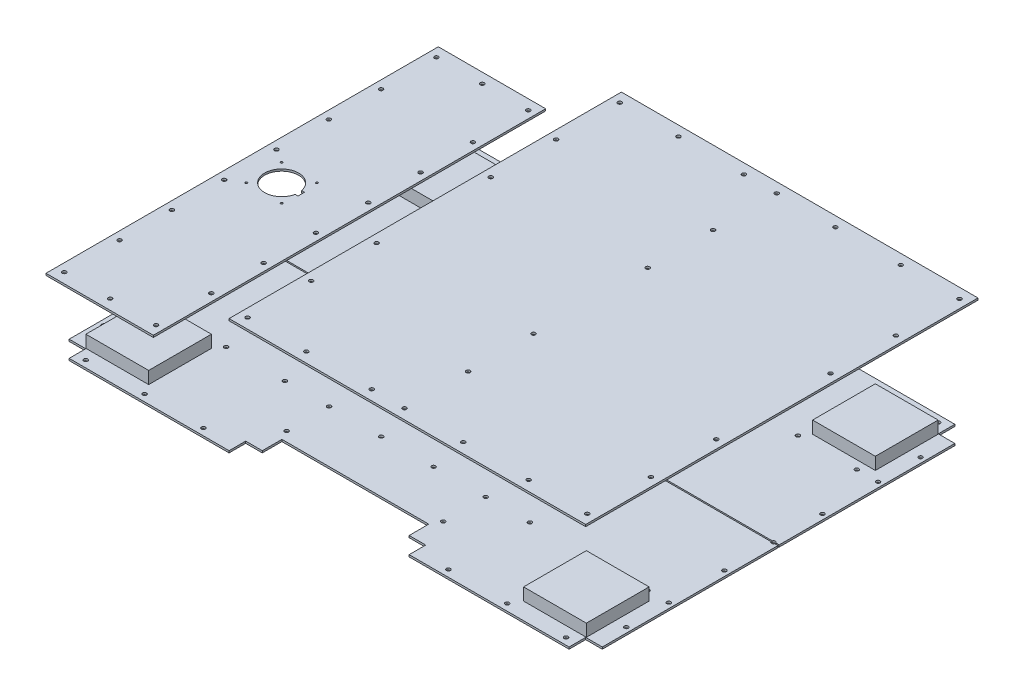
from build123d import *

# Parameters (mm, degrees)
SKETCH2_R             = 3
BOSS_EXTRUDE1_DEPTH   = 3
BOSS_EXTRUDE1_2_DEPTH = 3
SKETCH4_W             = 545.4
SKETCH4_H             = 600
SKETCH4_R             = 3
BOSS_EXTRUDE2_DEPTH   = 3
SKETCH6_R             = 3
BOSS_EXTRUDE3_DEPTH   = 3
CUT_EXTRUDE1_DEPTH    = 3
SKETCH10_R            = 1.6
CUT_EXTRUDE4_DEPTH    = 3
SKETCH13_W            = 90
SKETCH13_H            = 90
CUT_EXTRUDE6_DEPTH    = 3
BOSS_EXTRUDE4_START   = -3
SKETCH15_W            = 96
SKETCH15_H            = 96
BOSS_EXTRUDE4_DEPTH   = 18.8
SKETCH16_W            = 90
SKETCH16_H            = 90
CUT_EXTRUDE7_DEPTH    = 18.8


with BuildPart() as part:
    # Sketch2 → Boss-Extrude1 (new body)
    with BuildSketch(Plane(origin=(0, 422.059491285, 0), x_dir=(1, 0, 0), z_dir=(0, 1, 0))):
        with BuildLine():
            Line((711.295088764, -928.695168064), (711.295088764, -660.095168064))
            Line((711.295088764, -660.095168064), (706.223515889, -660.095168064))
            ThreePointArc((706.223515889, -660.095168064), (703.395088764, -662.095168064), (700.56666164, -660.095168064))
            Line((700.56666164, -660.095168064), (426.223515889, -660.095168064))
            ThreePointArc((426.223515889, -660.095168064), (423.395088764, -662.095168064), (420.56666164, -660.095168064))
            Line((420.56666164, -660.095168064), (186.623515889, -660.095168064))
            ThreePointArc((186.623515889, -660.095168064), (183.795088764, -662.095168064), (180.96666164, -660.095168064))
            Line((180.96666164, -660.095168064), (-93.376484111, -660.095168064))
            ThreePointArc((-93.376484111, -660.095168064), (-96.204911236, -662.095168064), (-99.03333836, -660.095168064))
            Line((-99.03333836, -660.095168064), (-104.104911236, -660.095168064))
            Line((-104.104911236, -660.095168064), (-104.104911236, -928.695168064))
            Line((-104.104911236, -928.695168064), (-78.704911236, -928.695168064))
            Line((-78.704911236, -928.695168064), (-78.704911236, -954.095168064))
            Line((-78.704911236, -954.095168064), (165.895088764, -954.095168064))
            Line((165.895088764, -954.095168064), (165.895088764, -928.695168064))
            Line((165.895088764, -928.695168064), (191.295088764, -928.695168064))
            Line((191.295088764, -928.695168064), (191.295088764, -898.695168064))
            Line((191.295088764, -898.695168064), (415.895088764, -898.695168064))
            Line((415.895088764, -898.695168064), (415.895088764, -928.695168064))
            Line((415.895088764, -928.695168064), (441.295088764, -928.695168064))
            Line((441.295088764, -928.695168064), (441.295088764, -954.095168064))
            Line((441.295088764, -954.095168064), (685.895088764, -954.095168064))
            Line((685.895088764, -954.095168064), (685.895088764, -928.695168064))
            Line((685.895088764, -928.695168064), (711.295088764, -928.695168064))
        make_face()
        with Locations(Location((-63.704911236, -943.695168064, 0), (0, 0, 270))):
            Circle(SKETCH2_R, mode=Mode.SUBTRACT)
        with Locations(Location((-96.204911236, -884.095168064, 0), (0, 0, 270))):
            Circle(SKETCH2_R, mode=Mode.SUBTRACT)
        with Locations(Location((26.295088764, -943.695168064, 0), (0, 0, 270))):
            Circle(SKETCH2_R, mode=Mode.SUBTRACT)
        with Locations(Location((-96.204911236, -819.095168064, 0), (0, 0, 270))):
            Circle(SKETCH2_R, mode=Mode.SUBTRACT)
        with Locations(Location((-63.704911236, -819.095168064, 0), (0, 0, 270))):
            Circle(SKETCH2_R, mode=Mode.SUBTRACT)
        with Locations(Location((26.295088764, -819.095168064, 0), (0, 0, 270))):
            Circle(SKETCH2_R, mode=Mode.SUBTRACT)
        with Locations(Location((116.295088764, -943.695168064, 0), (0, 0, 270))):
            Circle(SKETCH2_R, mode=Mode.SUBTRACT)
        with Locations(Location((183.795088764, -884.095168064, 0), (0, 0, 270))):
            Circle(SKETCH2_R, mode=Mode.SUBTRACT)
        with Locations(Location((116.295088764, -819.095168064, 0), (0, 0, 270))):
            Circle(SKETCH2_R, mode=Mode.SUBTRACT)
        with Locations(Location((183.795088764, -819.095168064, 0), (0, 0, 270))):
            Circle(SKETCH2_R, mode=Mode.SUBTRACT)
        with Locations(Location((263.595088764, -819.095168064, 0), (0, 0, 270))):
            Circle(SKETCH2_R, mode=Mode.SUBTRACT)
        with Locations(Location((-96.204911236, -734.095168064, 0), (0, 0, 270))):
            Circle(SKETCH2_R, mode=Mode.SUBTRACT)
        with Locations(Location((183.795088764, -734.095168064, 0), (0, 0, 270))):
            Circle(SKETCH2_R, mode=Mode.SUBTRACT)
        with Locations(Location((490.895088764, -943.695168064, 0), (0, 0, 270))):
            Circle(SKETCH2_R, mode=Mode.SUBTRACT)
        with Locations(Location((423.395088764, -884.095168064, 0), (0, 0, 270))):
            Circle(SKETCH2_R, mode=Mode.SUBTRACT)
        with Locations(Location((343.595088764, -819.095168064, 0), (0, 0, 270))):
            Circle(SKETCH2_R, mode=Mode.SUBTRACT)
        with Locations(Location((423.395088764, -819.095168064, 0), (0, 0, 270))):
            Circle(SKETCH2_R, mode=Mode.SUBTRACT)
        with Locations(Location((490.895088764, -819.095168064, 0), (0, 0, 270))):
            Circle(SKETCH2_R, mode=Mode.SUBTRACT)
        with Locations(Location((580.895088764, -943.695168064, 0), (0, 0, 270))):
            Circle(SKETCH2_R, mode=Mode.SUBTRACT)
        with Locations(Location((670.895088764, -943.695168064, 0), (0, 0, 270))):
            Circle(SKETCH2_R, mode=Mode.SUBTRACT)
        with Locations(Location((703.395088764, -884.095168064, 0), (0, 0, 270))):
            Circle(SKETCH2_R, mode=Mode.SUBTRACT)
        with Locations(Location((580.895088764, -819.095168064, 0), (0, 0, 270))):
            Circle(SKETCH2_R, mode=Mode.SUBTRACT)
        with Locations(Location((670.895088764, -819.095168064, 0), (0, 0, 270))):
            Circle(SKETCH2_R, mode=Mode.SUBTRACT)
        with Locations(Location((703.395088764, -819.095168064, 0), (0, 0, 270))):
            Circle(SKETCH2_R, mode=Mode.SUBTRACT)
        with Locations(Location((423.395088764, -734.095168064, 0), (0, 0, 270))):
            Circle(SKETCH2_R, mode=Mode.SUBTRACT)
        with Locations(Location((703.395088764, -734.095168064, 0), (0, 0, 270))):
            Circle(SKETCH2_R, mode=Mode.SUBTRACT)
    extrude(amount=BOSS_EXTRUDE1_DEPTH)


with BuildPart() as body_2:
    # Sketch2 → Boss-Extrude1 2 (new body)
    with BuildSketch(Plane(origin=(0, 422.059491285, 0), x_dir=(1, 0, 0), z_dir=(0, 1, 0))):
        with BuildLine():
            Line((426.223515889, -658.095168064), (700.56666164, -658.095168064))
            ThreePointArc((700.56666164, -658.095168064), (703.395088764, -656.095168064), (706.223515889, -658.095168064))
            Line((706.223515889, -658.095168064), (711.295088764, -658.095168064))
            Line((711.295088764, -658.095168064), (711.295088764, -389.495168064))
            Line((711.295088764, -389.495168064), (685.895088764, -389.495168064))
            Line((685.895088764, -389.495168064), (685.895088764, -364.095168064))
            Line((685.895088764, -364.095168064), (441.295088764, -364.095168064))
            Line((441.295088764, -364.095168064), (441.295088764, -389.495168064))
            Line((441.295088764, -389.495168064), (415.895088764, -389.495168064))
            Line((415.895088764, -389.495168064), (415.895088764, -419.495168064))
            Line((415.895088764, -419.495168064), (191.295088764, -419.495168064))
            Line((191.295088764, -419.495168064), (191.295088764, -389.495168064))
            Line((191.295088764, -389.495168064), (165.895088764, -389.495168064))
            Line((165.895088764, -389.495168064), (165.895088764, -364.095168064))
            Line((165.895088764, -364.095168064), (-78.704911236, -364.095168064))
            Line((-78.704911236, -364.095168064), (-78.704911236, -389.495168064))
            Line((-78.704911236, -389.495168064), (-104.104911236, -389.495168064))
            Line((-104.104911236, -389.495168064), (-104.104911236, -658.095168064))
            Line((-104.104911236, -658.095168064), (-99.03333836, -658.095168064))
            ThreePointArc((-99.03333836, -658.095168064), (-96.204911236, -656.095168064), (-93.376484111, -658.095168064))
            Line((-93.376484111, -658.095168064), (180.96666164, -658.095168064))
            ThreePointArc((180.96666164, -658.095168064), (183.795088764, -656.095168064), (186.623515889, -658.095168064))
            Line((186.623515889, -658.095168064), (420.56666164, -658.095168064))
            ThreePointArc((420.56666164, -658.095168064), (423.395088764, -656.095168064), (426.223515889, -658.095168064))
        make_face()
        with Locations(Location((-96.204911236, -584.095168064, 0), (0, 0, 270))):
            Circle(SKETCH2_R, mode=Mode.SUBTRACT)
        with Locations(Location((183.795088764, -584.095168064, 0), (0, 0, 270))):
            Circle(SKETCH2_R, mode=Mode.SUBTRACT)
        with Locations(Location((-96.204911236, -499.095168064, 0), (0, 0, 270))):
            Circle(SKETCH2_R, mode=Mode.SUBTRACT)
        with Locations(Location((-63.704911236, -499.095168064, 0), (0, 0, 270))):
            Circle(SKETCH2_R, mode=Mode.SUBTRACT)
        with Locations(Location((26.295088764, -499.095168064, 0), (0, 0, 270))):
            Circle(SKETCH2_R, mode=Mode.SUBTRACT)
        with Locations(Location((-96.204911236, -434.095168064, 0), (0, 0, 270))):
            Circle(SKETCH2_R, mode=Mode.SUBTRACT)
        with Locations(Location((-63.704911236, -374.495168064, 0), (0, 0, 270))):
            Circle(SKETCH2_R, mode=Mode.SUBTRACT)
        with Locations(Location((26.295088764, -374.495168064, 0), (0, 0, 270))):
            Circle(SKETCH2_R, mode=Mode.SUBTRACT)
        with Locations(Location((116.295088764, -499.095168064, 0), (0, 0, 270))):
            Circle(SKETCH2_R, mode=Mode.SUBTRACT)
        with Locations(Location((183.795088764, -499.095168064, 0), (0, 0, 270))):
            Circle(SKETCH2_R, mode=Mode.SUBTRACT)
        with Locations(Location((263.595088764, -499.095168064, 0), (0, 0, 270))):
            Circle(SKETCH2_R, mode=Mode.SUBTRACT)
        with Locations(Location((183.795088764, -434.095168064, 0), (0, 0, 270))):
            Circle(SKETCH2_R, mode=Mode.SUBTRACT)
        with Locations(Location((116.295088764, -374.495168064, 0), (0, 0, 270))):
            Circle(SKETCH2_R, mode=Mode.SUBTRACT)
        with Locations(Location((423.395088764, -584.095168064, 0), (0, 0, 270))):
            Circle(SKETCH2_R, mode=Mode.SUBTRACT)
        with Locations(Location((703.395088764, -584.095168064, 0), (0, 0, 270))):
            Circle(SKETCH2_R, mode=Mode.SUBTRACT)
        with Locations(Location((343.595088764, -499.095168064, 0), (0, 0, 270))):
            Circle(SKETCH2_R, mode=Mode.SUBTRACT)
        with Locations(Location((423.395088764, -499.095168064, 0), (0, 0, 270))):
            Circle(SKETCH2_R, mode=Mode.SUBTRACT)
        with Locations(Location((490.895088764, -499.095168064, 0), (0, 0, 270))):
            Circle(SKETCH2_R, mode=Mode.SUBTRACT)
        with Locations(Location((423.395088764, -434.095168064, 0), (0, 0, 270))):
            Circle(SKETCH2_R, mode=Mode.SUBTRACT)
        with Locations(Location((490.895088764, -374.495168064, 0), (0, 0, 270))):
            Circle(SKETCH2_R, mode=Mode.SUBTRACT)
        with Locations(Location((580.895088764, -499.095168064, 0), (0, 0, 270))):
            Circle(SKETCH2_R, mode=Mode.SUBTRACT)
        with Locations(Location((670.895088764, -499.095168064, 0), (0, 0, 270))):
            Circle(SKETCH2_R, mode=Mode.SUBTRACT)
        with Locations(Location((703.395088764, -499.095168064, 0), (0, 0, 270))):
            Circle(SKETCH2_R, mode=Mode.SUBTRACT)
        with Locations(Location((580.895088764, -374.495168064, 0), (0, 0, 270))):
            Circle(SKETCH2_R, mode=Mode.SUBTRACT)
        with Locations(Location((703.395088764, -434.095168064, 0), (0, 0, 270))):
            Circle(SKETCH2_R, mode=Mode.SUBTRACT)
        with Locations(Location((670.895088764, -374.495168064, 0), (0, 0, 270))):
            Circle(SKETCH2_R, mode=Mode.SUBTRACT)
    extrude(amount=BOSS_EXTRUDE1_2_DEPTH)


with BuildPart() as body_3:
    # Sketch4 → Boss-Extrude2 (new body)
    with BuildSketch(Plane(origin=(0, 602.059491285, 0), x_dir=(1, 0, 0), z_dir=(0, 1, 0))):
        with Locations((443.595088764, -659.095168064)):
            Rectangle(SKETCH4_W, SKETCH4_H)
        with Locations(Location((423.795088764, -746.395168064, 0), (0, 0, 270))):
            Circle(SKETCH4_R, mode=Mode.SUBTRACT)
        with Locations(Location((183.795088764, -846.395168064, 0), (0, 0, 270))):
            Circle(SKETCH4_R, mode=Mode.SUBTRACT)
        with Locations(Location((183.795088764, -746.395168064, 0), (0, 0, 270))):
            Circle(SKETCH4_R, mode=Mode.SUBTRACT)
        with Locations(Location((183.795088764, -943.695168064, 0), (0, 0, 270))):
            Circle(SKETCH4_R, mode=Mode.SUBTRACT)
        with Locations(Location((273.595088764, -943.695168064, 0), (0, 0, 270))):
            Circle(SKETCH4_R, mode=Mode.SUBTRACT)
        with Locations(Location((373.595088764, -943.695168064, 0), (0, 0, 270))):
            Circle(SKETCH4_R, mode=Mode.SUBTRACT)
        with Locations(Location((423.795088764, -846.395168064, 0), (0, 0, 270))):
            Circle(SKETCH4_R, mode=Mode.SUBTRACT)
        with Locations(Location((423.795088764, -943.695168064, 0), (0, 0, 270))):
            Circle(SKETCH4_R, mode=Mode.SUBTRACT)
        with Locations(Location((703.395088764, -746.395168064, 0), (0, 0, 270))):
            Circle(SKETCH4_R, mode=Mode.SUBTRACT)
        with Locations(Location((703.395088764, -846.395168064, 0), (0, 0, 270))):
            Circle(SKETCH4_R, mode=Mode.SUBTRACT)
        with Locations(Location((513.595088764, -943.695168064, 0), (0, 0, 270))):
            Circle(SKETCH4_R, mode=Mode.SUBTRACT)
        with Locations(Location((703.395088764, -943.695168064, 0), (0, 0, 270))):
            Circle(SKETCH4_R, mode=Mode.SUBTRACT)
        with Locations(Location((613.595088764, -943.695168064, 0), (0, 0, 270))):
            Circle(SKETCH4_R, mode=Mode.SUBTRACT)
        with Locations(Location((613.595088764, -374.495168064, 0), (0, 0, 90))):
            Circle(SKETCH4_R, mode=Mode.SUBTRACT)
        with Locations(Location((703.395088764, -374.495168064, 0), (0, 0, 90))):
            Circle(SKETCH4_R, mode=Mode.SUBTRACT)
        with Locations(Location((513.595088764, -374.495168064, 0), (0, 0, 90))):
            Circle(SKETCH4_R, mode=Mode.SUBTRACT)
        with Locations(Location((703.395088764, -471.795168064, 0), (0, 0, 90))):
            Circle(SKETCH4_R, mode=Mode.SUBTRACT)
        with Locations(Location((703.395088764, -571.795168064, 0), (0, 0, 90))):
            Circle(SKETCH4_R, mode=Mode.SUBTRACT)
        with Locations(Location((423.795088764, -374.495168064, 0), (0, 0, 90))):
            Circle(SKETCH4_R, mode=Mode.SUBTRACT)
        with Locations(Location((423.795088764, -471.795168064, 0), (0, 0, 90))):
            Circle(SKETCH4_R, mode=Mode.SUBTRACT)
        with Locations(Location((373.595088764, -374.495168064, 0), (0, 0, 90))):
            Circle(SKETCH4_R, mode=Mode.SUBTRACT)
        with Locations(Location((273.595088764, -374.495168064, 0), (0, 0, 90))):
            Circle(SKETCH4_R, mode=Mode.SUBTRACT)
        with Locations(Location((183.795088764, -374.495168064, 0), (0, 0, 90))):
            Circle(SKETCH4_R, mode=Mode.SUBTRACT)
        with Locations(Location((183.795088764, -571.795168064, 0), (0, 0, 90))):
            Circle(SKETCH4_R, mode=Mode.SUBTRACT)
        with Locations(Location((183.795088764, -471.795168064, 0), (0, 0, 90))):
            Circle(SKETCH4_R, mode=Mode.SUBTRACT)
        with Locations(Location((423.795088764, -571.795168064, 0), (0, 0, 90))):
            Circle(SKETCH4_R, mode=Mode.SUBTRACT)
    extrude(amount=BOSS_EXTRUDE2_DEPTH)


with BuildPart() as body_4:
    # Sketch6 → Boss-Extrude3 (new body)
    with BuildSketch(Plane(origin=(0, 522.059491285, 0), x_dir=(1, 0, 0), z_dir=(0, 1, 0))):
        Polygon((-109.104911236, -959.095168064), (-109.104911236, -359.095168064), (55.095088764, -359.095168064), (55.095088764, -384.495168064), (55.095088764, -933.695168064), (55.095088764, -959.095168064), align=None)
        with Locations(Location((-96.604911236, -943.695168064, 0), (0, 0, 270))):
            Circle(SKETCH6_R, mode=Mode.SUBTRACT)
        with Locations(Location((-26.399911236, -943.695168064, 0), (0, 0, 270))):
            Circle(SKETCH6_R, mode=Mode.SUBTRACT)
        with Locations(Location((43.795088764, -943.695168064, 0), (0, 0, 270))):
            Circle(SKETCH6_R, mode=Mode.SUBTRACT)
        with Locations(Location((-96.604911236, -859.095168064, 0), (0, 0, 270))):
            Circle(SKETCH6_R, mode=Mode.SUBTRACT)
        with Locations(Location((43.795088764, -859.095168064, 0), (0, 0, 270))):
            Circle(SKETCH6_R, mode=Mode.SUBTRACT)
        with Locations(Location((43.795088764, -699.095168064, 0), (0, 0, 270))):
            Circle(SKETCH6_R, mode=Mode.SUBTRACT)
        with Locations(Location((-96.604911236, -699.095168064, 0), (0, 0, 270))):
            Circle(SKETCH6_R, mode=Mode.SUBTRACT)
        with Locations(Location((43.795088764, -779.095168064, 0), (0, 0, 270))):
            Circle(SKETCH6_R, mode=Mode.SUBTRACT)
        with Locations(Location((-96.604911236, -779.095168064, 0), (0, 0, 270))):
            Circle(SKETCH6_R, mode=Mode.SUBTRACT)
        with Locations(Location((-96.604911236, -619.095168064, 0), (0, 0, 90))):
            Circle(SKETCH6_R, mode=Mode.SUBTRACT)
        with Locations(Location((-96.604911236, -539.095168064, 0), (0, 0, 90))):
            Circle(SKETCH6_R, mode=Mode.SUBTRACT)
        with Locations(Location((43.795088764, -539.095168064, 0), (0, 0, 90))):
            Circle(SKETCH6_R, mode=Mode.SUBTRACT)
        with Locations(Location((43.795088764, -619.095168064, 0), (0, 0, 90))):
            Circle(SKETCH6_R, mode=Mode.SUBTRACT)
        with Locations(Location((43.795088764, -459.095168064, 0), (0, 0, 90))):
            Circle(SKETCH6_R, mode=Mode.SUBTRACT)
        with Locations(Location((-96.604911236, -459.095168064, 0), (0, 0, 90))):
            Circle(SKETCH6_R, mode=Mode.SUBTRACT)
        with Locations(Location((43.795088764, -374.495168064, 0), (0, 0, 90))):
            Circle(SKETCH6_R, mode=Mode.SUBTRACT)
        with Locations(Location((-26.399911236, -374.495168064, 0), (0, 0, 90))):
            Circle(SKETCH6_R, mode=Mode.SUBTRACT)
        with Locations(Location((-96.604911236, -374.495168064, 0), (0, 0, 90))):
            Circle(SKETCH6_R, mode=Mode.SUBTRACT)
    extrude(amount=BOSS_EXTRUDE3_DEPTH)

    # Sketch9 → Cut-Extrude1 (cut)
    with BuildSketch(Plane(origin=(0, 525.059491285, 0), x_dir=(1, 0, 0), z_dir=(0, 1, 0))):
        with BuildLine():
            Line((-23.190209591, -654.095168064), (-18.690209591, -654.095168064))
            Line((-18.690209591, -654.095168064), (-18.690209591, -664.095168064))
            Line((-18.690209591, -664.095168064), (-23.190209591, -664.095168064))
            ThreePointArc((-23.190209591, -664.095168064), (-74.704911236, -659.095168064), (-23.190209591, -654.095168064))
        make_face()
    extrude(amount=-CUT_EXTRUDE1_DEPTH, mode=Mode.SUBTRACT)

    # Sketch10 → Cut-Extrude4 (cut)
    with BuildSketch(Plane(origin=(0, 525.059491285, 0), x_dir=(1, 0, 0), z_dir=(0, 1, 0))):
        with Locations(Location((-21.704911236, -632.095168064, 0), (0, 0, 270))):
            Circle(SKETCH10_R)
        with Locations(Location((-21.704911236, -686.095168064, 0), (0, 0, 270))):
            Circle(SKETCH10_R)
        with Locations(Location((-75.704911236, -632.095168064, 0), (0, 0, 270))):
            Circle(SKETCH10_R)
        with Locations(Location((-75.704911236, -686.095168064, 0), (0, 0, 270))):
            Circle(SKETCH10_R)
    extrude(amount=-CUT_EXTRUDE4_DEPTH, mode=Mode.SUBTRACT)


with BuildPart() as cut_extrude6_tool:
    # Sketch13 → Cut-Extrude6 (new body)
    with BuildSketch(Plane.XZ.offset(-422.059491285)):
        with Locations((-31.104911236, 880.095168064)):
            Rectangle(SKETCH13_W, SKETCH13_H)
        with Locations((-31.104911236, 438.095168064)):
            Rectangle(SKETCH13_W, SKETCH13_H)
        with Locations((638.295088764, 438.095168064)):
            Rectangle(SKETCH13_W, SKETCH13_H)
        with Locations((638.295088764, 880.095168064)):
            Rectangle(SKETCH13_W, SKETCH13_H)
    extrude(amount=-CUT_EXTRUDE6_DEPTH)


with BuildPart() as part_1:
    add(part.part)

    # Cut-Extrude6: cut by cut_extrude6_tool
    add(cut_extrude6_tool.part, mode=Mode.SUBTRACT)



with BuildPart() as body_2_1:
    add(body_2.part)

    # Cut-Extrude6: cut by cut_extrude6_tool
    add(cut_extrude6_tool.part, mode=Mode.SUBTRACT)


with BuildPart() as part_2:
    add(part_1.part)

    add(body_2_1.part)  # Boss-Extrude4 merges body 2
    # Sketch15 → Boss-Extrude4 (add)
    with BuildSketch(Plane.XZ.offset(-422.059491285).offset(BOSS_EXTRUDE4_START)):
        with Locations((-31.104911236, 438.095168064)):
            Rectangle(SKETCH15_W, SKETCH15_H)
        with Locations((-31.104911236, 880.095168064)):
            Rectangle(SKETCH15_W, SKETCH15_H)
        with Locations((638.295088764, 438.095168064)):
            Rectangle(SKETCH15_W, SKETCH15_H)
        with Locations((638.295088764, 880.095168064)):
            Rectangle(SKETCH15_W, SKETCH15_H)
    extrude(amount=-BOSS_EXTRUDE4_DEPTH)

    # Sketch16 → Cut-Extrude7 (cut)
    with BuildSketch(Plane.XZ.offset(-422.059491285)):
        with Locations((-31.104911236, 880.095168064)):
            Rectangle(SKETCH16_W, SKETCH16_H)
        with Locations((-31.104911236, 438.095168064)):
            Rectangle(SKETCH16_W, SKETCH16_H)
        with Locations((638.295088764, 880.095168064)):
            Rectangle(SKETCH16_W, SKETCH16_H)
        with Locations((638.295088764, 438.095168064)):
            Rectangle(SKETCH16_W, SKETCH16_H)
    extrude(amount=-CUT_EXTRUDE7_DEPTH, mode=Mode.SUBTRACT)


solid = Compound([body_3.part, body_4.part, part_2.part])
